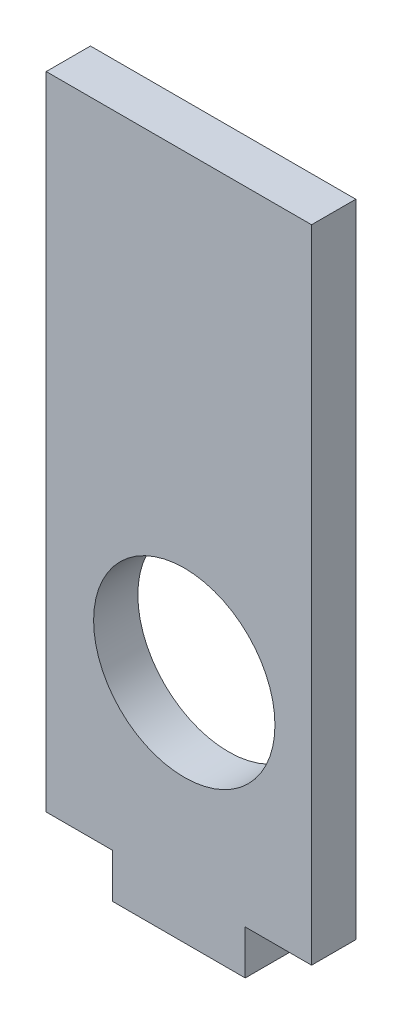
from build123d import *

# Parameters (mm, degrees)
EXTRUDE_1_DEPTH     = 2
SKETCH_2_R          = 4.1
CUT_EXTRUDE_1_DEPTH = 10
SKETCH_3_W          = 12
SKETCH_3_H          = 1.078774048
CUT_EXTRUDE_2_DEPTH = 10


with BuildPart() as part:
    # 草图1 → 凸台-拉伸1 (new body)
    with BuildSketch(Plane.XY):
        Polygon((-6, 0), (-6, 15), (-6, 30.078774409), (6, 30.078774409), (6, 15), (6, 0), (3, 0), (3, -2), (-3, -2), (-3, 0), align=None)
    extrude(amount=EXTRUDE_1_DEPTH)

    # 草图2 → 切除-拉伸1 (cut)
    with BuildSketch(Plane.XY.offset(2)):
        with Locations((0.243619751, 8.579446227)):
            Circle(SKETCH_2_R)
    extrude(amount=-CUT_EXTRUDE_1_DEPTH, mode=Mode.SUBTRACT)

    # 草图3 → 切除-拉伸2 (cut)
    with BuildSketch(Plane.XY.offset(2)):
        with Locations((0, 29.539387385)):
            Rectangle(SKETCH_3_W, SKETCH_3_H)
        Polygon((6, 29.000000361), (10.298878861, 29.000000361), (10.298878861, 34.143483695), (-9.585000786, 34.143483695), (-9.585000786, 29.000000361), (-6, 29.000000361), (-6, 30.078774409), (6, 30.078774409), align=None)
    extrude(amount=-CUT_EXTRUDE_2_DEPTH, mode=Mode.SUBTRACT)


solid = part.part
